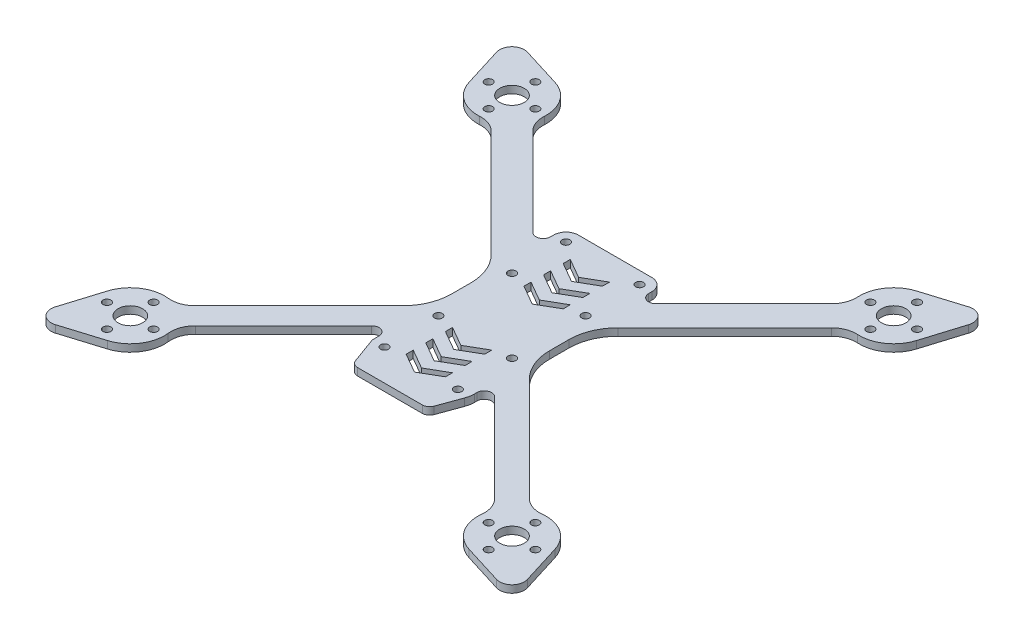
from build123d import *

# Parameters (mm, degrees)
SKETCH1_R           = 1.6
SKETCH1_R_2         = 5
BOSS_EXTRUDE1_DEPTH = 3
CUT_EXTRUDE1_DEPTH  = 137.389779764


with BuildPart() as part:
    # Sketch1 → Boss-Extrude1 (new body)
    with BuildSketch(Plane(origin=(0, 0, 0), x_dir=(1, 0, 0), z_dir=(0, 1, 0))):
        with BuildLine():
            Line((19.341013177, -38.656931626), (16.02192173, -47.77606043))
            ThreePointArc((16.02192173, -47.77606043), (14.923573177, -49.207456133), (13.202843868, -49.75))
            Line((13.202843868, -49.75), (-13.202843868, -49.75))
            ThreePointArc((-13.202843868, -49.75), (-14.923573177, -49.207456133), (-16.02192173, -47.77606043))
            Line((-16.02192173, -47.77606043), (-19.944086969, -37))
            Line((-19.944086969, -37), (-19.944086969, -34.257795468))
            ThreePointArc((-19.944086969, -34.257795468), (-21.796036672, -31.486156871), (-25.065407313, -32.136475125))
            Line((-25.065407313, -32.136475125), (-60.998570725, -68.069638537))
            ThreePointArc((-60.998570725, -68.069638537), (-63.363139484, -71.828794135), (-63.866770837, -76.241139508))
            ThreePointArc((-63.866770837, -76.241139508), (-66.073761636, -85.457884527), (-73.646067483, -91.156952986))
            Line((-73.646067483, -91.156952986), (-89.941777265, -96.195664945))
            ThreePointArc((-89.941777265, -96.195664945), (-94.954339188, -94.954339188), (-96.195664945, -89.941777265))
            Line((-96.195664945, -89.941777265), (-91.156952986, -73.646067483))
            ThreePointArc((-91.156952986, -73.646067483), (-85.457884527, -66.073761636), (-76.241139508, -63.866770837))
            ThreePointArc((-76.241139508, -63.866770837), (-71.828794135, -63.363139484), (-68.069638537, -60.998570725))
            Line((-68.069638537, -60.998570725), (-25.857864376, -18.786796564))
            ThreePointArc((-25.857864376, -18.786796564), (-21.52240935, -12.298329588), (-20, -4.644660941))
            Line((-20, -4.644660941), (-20, 3.230447378))
            ThreePointArc((-20, 3.230447378), (-21.52240935, 10.884116026), (-25.857864376, 17.372583002))
            Line((-25.857864376, 17.372583002), (-69.375275977, 60.889994603))
            ThreePointArc((-69.375275977, 60.889994603), (-72.878122891, 63.16065038), (-77.002761348, 63.803434766))
            ThreePointArc((-77.002761348, 63.803434766), (-85.774590221, 66.287641348), (-91.156952986, 73.646067483))
            Line((-91.156952986, 73.646067483), (-96.195664945, 89.941777265))
            ThreePointArc((-96.195664945, 89.941777265), (-94.954339188, 94.954339188), (-89.941777265, 96.195664945))
            Line((-89.941777265, 96.195664945), (-73.646067483, 91.156952986))
            ThreePointArc((-73.646067483, 91.156952986), (-66.287641348, 85.774590221), (-63.803434766, 77.002761348))
            ThreePointArc((-63.803434766, 77.002761348), (-63.16065038, 72.878122891), (-60.889994603, 69.375275977))
            Line((-60.889994603, 69.375275977), (-25.121320344, 33.606601718))
            ThreePointArc((-25.121320344, 33.606601718), (-21.851949703, 32.956283464), (-20, 35.727922061))
            Line((-20, 35.727922061), (-20, 37))
            ThreePointArc((-20, 37), (-18.535533906, 40.535533906), (-15, 42))
            Line((-15, 42), (15, 42))
            ThreePointArc((15, 42), (18.535533906, 40.535533906), (20, 37))
            Line((20, 37), (20, 35.727922061))
            ThreePointArc((20, 35.727922061), (21.851949703, 32.956283464), (25.121320344, 33.606601718))
            Line((25.121320344, 33.606601718), (60.889994603, 69.375275977))
            ThreePointArc((60.889994603, 69.375275977), (63.16065038, 72.878122891), (63.803434766, 77.002761348))
            ThreePointArc((63.803434766, 77.002761348), (66.287641348, 85.774590221), (73.646067483, 91.156952986))
            Line((73.646067483, 91.156952986), (89.941777265, 96.195664945))
            ThreePointArc((89.941777265, 96.195664945), (94.954339188, 94.954339188), (96.195664945, 89.941777265))
            Line((96.195664945, 89.941777265), (91.156952986, 73.646067483))
            ThreePointArc((91.156952986, 73.646067483), (85.774590221, 66.287641348), (77.002761348, 63.803434766))
            ThreePointArc((77.002761348, 63.803434766), (72.878122891, 63.16065038), (69.375275977, 60.889994603))
            Line((69.375275977, 60.889994603), (25.857864376, 17.372583002))
            ThreePointArc((25.857864376, 17.372583002), (21.52240935, 10.884116026), (20, 3.230447378))
            Line((20, 3.230447378), (20, -4.644660941))
            ThreePointArc((20, -4.644660941), (21.52240935, -12.298329588), (25.857864376, -18.786796564))
            Line((25.857864376, -18.786796564), (68.069638537, -60.998570725))
            ThreePointArc((68.069638537, -60.998570725), (71.828794135, -63.363139484), (76.241139508, -63.866770837))
            ThreePointArc((76.241139508, -63.866770837), (85.457884527, -66.073761636), (91.156952986, -73.646067483))
            Line((91.156952986, -73.646067483), (96.195664945, -89.941777265))
            ThreePointArc((96.195664945, -89.941777265), (94.954339188, -94.954339188), (89.941777265, -96.195664945))
            Line((89.941777265, -96.195664945), (73.646067483, -91.156952986))
            ThreePointArc((73.646067483, -91.156952986), (66.073761636, -85.457884527), (63.866770837, -76.241139508))
            ThreePointArc((63.866770837, -76.241139508), (63.363139484, -71.828794135), (60.998570725, -68.069638537))
            Line((60.998570725, -68.069638537), (25.065407313, -32.136475125))
            ThreePointArc((25.065407313, -32.136475125), (21.796036672, -31.486156871), (19.944086969, -34.257795468))
            Line((19.944086969, -34.257795468), (19.944086969, -35.236730193))
            ThreePointArc((19.944086969, -35.236730193), (19.792164499, -36.97321197), (19.341013177, -38.656931626))
        make_face()
        with Locations(Location((77.781745931, 68.281745931, 0), (0, 0, 270))):
            Circle(SKETCH1_R, mode=Mode.SUBTRACT)
        with Locations(Location((68.281745931, 77.781745931, 0), (0, 0, 270))):
            Circle(SKETCH1_R, mode=Mode.SUBTRACT)
        with Locations(Location((77.781745931, 87.281745931, 0), (0, 0, 270))):
            Circle(SKETCH1_R, mode=Mode.SUBTRACT)
        with Locations(Location((87.281745931, 77.781745931, 0), (0, 0, 270))):
            Circle(SKETCH1_R, mode=Mode.SUBTRACT)
        with Locations(Location((77.781745931, -87.281745931, 0), (0, 0, 270))):
            Circle(SKETCH1_R, mode=Mode.SUBTRACT)
        with Locations(Location((68.281745931, -77.781745931, 0), (0, 0, 270))):
            Circle(SKETCH1_R, mode=Mode.SUBTRACT)
        with Locations(Location((77.781745931, -68.281745931, 0), (0, 0, 270))):
            Circle(SKETCH1_R, mode=Mode.SUBTRACT)
        with Locations(Location((87.281745931, -77.781745931, 0), (0, 0, 270))):
            Circle(SKETCH1_R, mode=Mode.SUBTRACT)
        with Locations(Location((15, 15, 0), (0, 0, 270))):
            Circle(SKETCH1_R, mode=Mode.SUBTRACT)
        with Locations(Location((15, -15, 0), (0, 0, 270))):
            Circle(SKETCH1_R, mode=Mode.SUBTRACT)
        with Locations(Location((77.781745931, 77.781745931, 0), (0, 0, 270))):
            Circle(SKETCH1_R_2, mode=Mode.SUBTRACT)
        with Locations(Location((77.781745931, -77.781745931, 0), (0, 0, 270))):
            Circle(SKETCH1_R_2, mode=Mode.SUBTRACT)
        with Locations(Location((14.944086969, -37, 0), (0, 0, 90))):
            Circle(SKETCH1_R, mode=Mode.SUBTRACT)
        with Locations(Location((15, 37, 0), (0, 0, 90))):
            Circle(SKETCH1_R, mode=Mode.SUBTRACT)
        with Locations(Location((-15, 37, 0), (0, 0, 270))):
            Circle(SKETCH1_R, mode=Mode.SUBTRACT)
        with Locations(Location((-14.944086969, -37, 0), (0, 0, 270))):
            Circle(SKETCH1_R, mode=Mode.SUBTRACT)
        with Locations(Location((-77.781745931, -77.781745931, 0), (0, 0, 90))):
            Circle(SKETCH1_R_2, mode=Mode.SUBTRACT)
        with Locations(Location((-77.781745931, 77.781745931, 0), (0, 0, 90))):
            Circle(SKETCH1_R_2, mode=Mode.SUBTRACT)
        with Locations(Location((-15, -15, 0), (0, 0, 90))):
            Circle(SKETCH1_R, mode=Mode.SUBTRACT)
        with Locations(Location((-15, 15, 0), (0, 0, 90))):
            Circle(SKETCH1_R, mode=Mode.SUBTRACT)
        with Locations(Location((-87.281745931, -77.781745931, 0), (0, 0, 90))):
            Circle(SKETCH1_R, mode=Mode.SUBTRACT)
        with Locations(Location((-77.781745931, -68.281745931, 0), (0, 0, 90))):
            Circle(SKETCH1_R, mode=Mode.SUBTRACT)
        with Locations(Location((-68.281745931, -77.781745931, 0), (0, 0, 90))):
            Circle(SKETCH1_R, mode=Mode.SUBTRACT)
        with Locations(Location((-77.781745931, -87.281745931, 0), (0, 0, 90))):
            Circle(SKETCH1_R, mode=Mode.SUBTRACT)
        with Locations(Location((-87.281745931, 77.781745931, 0), (0, 0, 90))):
            Circle(SKETCH1_R, mode=Mode.SUBTRACT)
        with Locations(Location((-77.781745931, 87.281745931, 0), (0, 0, 90))):
            Circle(SKETCH1_R, mode=Mode.SUBTRACT)
        with Locations(Location((-68.281745931, 77.781745931, 0), (0, 0, 90))):
            Circle(SKETCH1_R, mode=Mode.SUBTRACT)
        with Locations(Location((-77.781745931, 68.281745931, 0), (0, 0, 90))):
            Circle(SKETCH1_R, mode=Mode.SUBTRACT)
    extrude(amount=BOSS_EXTRUDE1_DEPTH)

    # Sketch2 → Cut-Extrude1 (cut, through all)
    with BuildSketch(Plane.XZ):
        Polygon((-8, 35.131197846), (0, 39.75), (8, 35.131197846), (8, 32.244446501), (0, 36.863248654), (-8, 32.244446501), align=None)
        Polygon((-8, 27.131197846), (0, 31.75), (8, 27.131197846), (8, 24.244446501), (0, 28.863248654), (-8, 24.244446501), align=None)
        Polygon((-8, 19.131197846), (0, 23.75), (8, 19.131197846), (8, 16.244446501), (0, 20.863248654), (-8, 16.244446501), align=None)
        Polygon((-8, -12.868802154), (0, -8.25), (8, -12.868802154), (8, -15.755553499), (0, -11.136751346), (-8, -15.755553499), align=None)
        Polygon((-8, -20.868802154), (0, -16.25), (8, -20.868802154), (8, -23.755553499), (0, -19.136751346), (-8, -23.755553499), align=None)
        Polygon((-8, -28.868802154), (0, -24.25), (8, -28.868802154), (8, -31.755553499), (0, -27.136751346), (-8, -31.755553499), align=None)
    extrude(amount=-CUT_EXTRUDE1_DEPTH, mode=Mode.SUBTRACT)


solid = part.part
